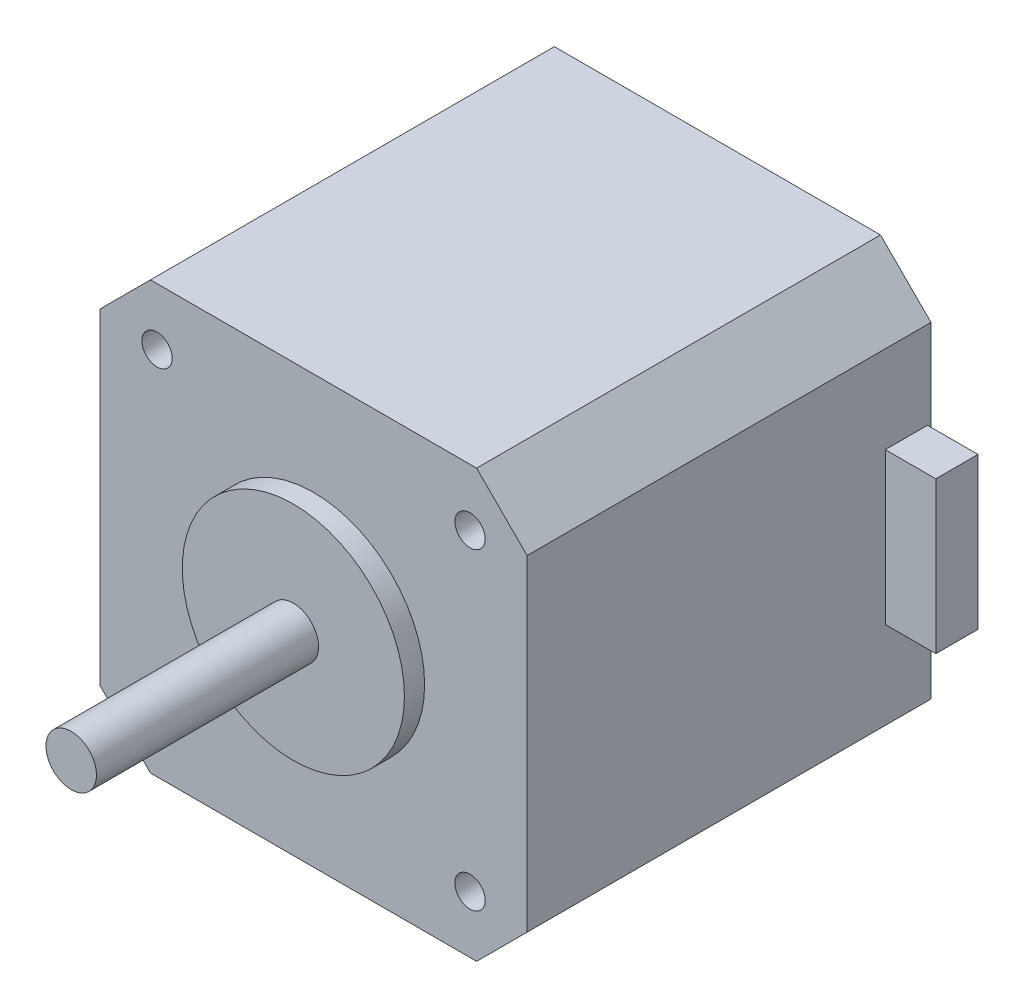
from build123d import *

# Parameters (mm, degrees)
RESSALTO_EXTRUS_O1_DEPTH = 40
ESBO_O2_R                = 11
RESSALTO_EXTRUS_O2_DEPTH = 2
ESBO_O3_R                = 2.5
RESSALTO_EXTRUS_O3_DEPTH = 22
ESBO_O4_R                = 1.5
CORTE_EXTRUS_O1_DEPTH    = 15
ESBO_O5_W                = 4.17956517
ESBO_O5_H                = 15
RESSALTO_EXTRUS_O4_DEPTH = 5


with BuildPart() as part:
    # Esboço1 → Ressalto-extrusão1 (new body)
    with BuildSketch(Plane.XY):
        Polygon((-21.15, 16.15), (-16.15, 21.15), (16.15, 21.15), (21.15, 16.15), (21.15, -16.15), (16.15, -21.15), (-16.15, -21.15), (-21.15, -16.15), align=None)
    extrude(amount=RESSALTO_EXTRUS_O1_DEPTH)

    # Esboço2 → Ressalto-extrusão2 (add)
    with BuildSketch(Plane.XY.offset(40)):
        Circle(ESBO_O2_R)
    extrude(amount=RESSALTO_EXTRUS_O2_DEPTH)

    # Esboço3 → Ressalto-extrusão3 (add)
    with BuildSketch(Plane.XY.offset(42)):
        Circle(ESBO_O3_R)
    extrude(amount=RESSALTO_EXTRUS_O3_DEPTH)

    # Esboço4 → Corte-extrusão1 (cut)
    with BuildSketch(Plane.XY.offset(40)):
        with Locations((15.5, -15.5)):
            Circle(ESBO_O4_R)
        with Locations((15.5, 15.5)):
            Circle(ESBO_O4_R)
        with Locations((-15.5, -15.5)):
            Circle(ESBO_O4_R)
        with Locations((-15.5, 15.5)):
            Circle(ESBO_O4_R)
    extrude(amount=-CORTE_EXTRUS_O1_DEPTH, mode=Mode.SUBTRACT)

    # Esboço5 → Ressalto-extrusão4 (add)
    with BuildSketch(Plane(origin=(21.15, 0, 0), x_dir=(0, 0, -1), z_dir=(1, 0, 0))):
        with Locations((-2.436524566, 0)):
            Rectangle(ESBO_O5_W, ESBO_O5_H)
    extrude(amount=RESSALTO_EXTRUS_O4_DEPTH)


solid = part.part
